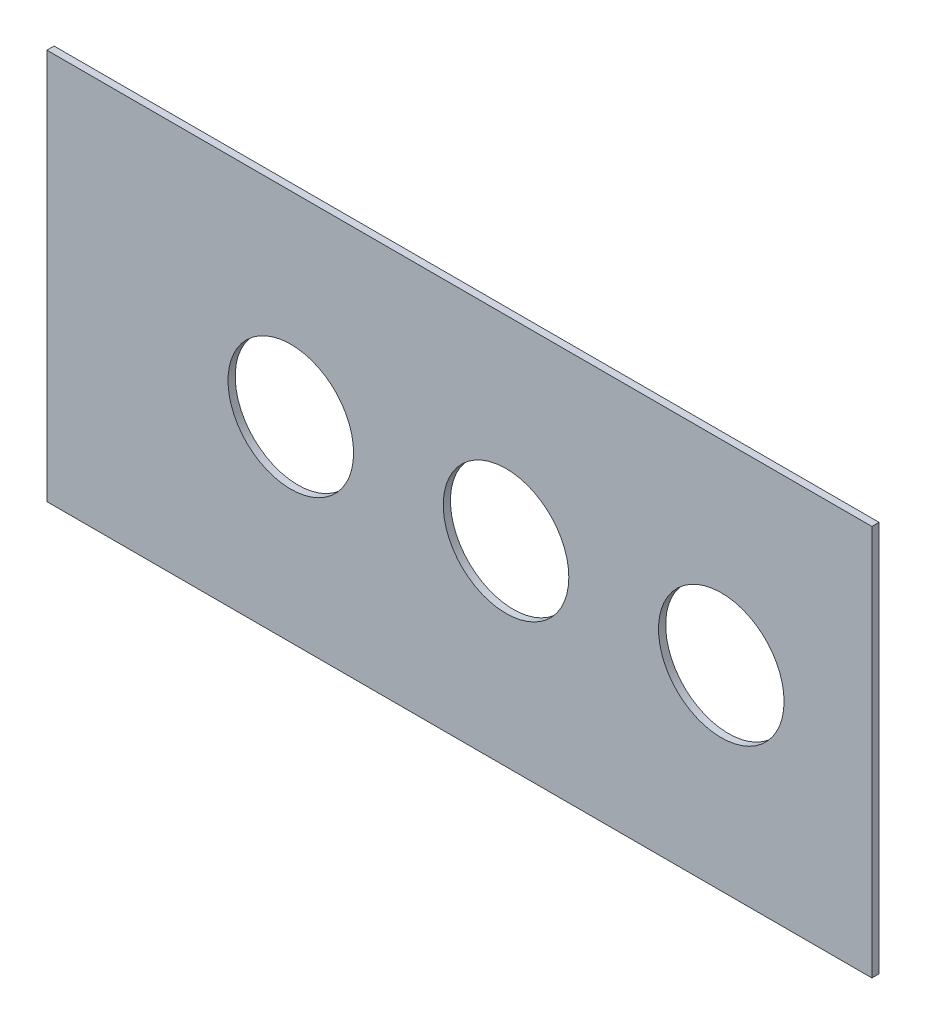
from build123d import *

# Parameters (mm, degrees)
SKETCH1_W           = 1150
SKETCH1_H           = 545
SKETCH1_R           = 87.5
BOSS_EXTRUDE1_DEPTH = 10


with BuildPart() as part:
    # Sketch1 → Boss-Extrude1 (new body)
    with BuildSketch(Plane.XY):
        with Locations((-65, 0)):
            Rectangle(SKETCH1_W, SKETCH1_H)
        with Locations((-300, 0)):
            Circle(SKETCH1_R, mode=Mode.SUBTRACT)
        Circle(SKETCH1_R, mode=Mode.SUBTRACT)
        with Locations((300, 0)):
            Circle(SKETCH1_R, mode=Mode.SUBTRACT)
    extrude(amount=BOSS_EXTRUDE1_DEPTH)


solid = part.part
